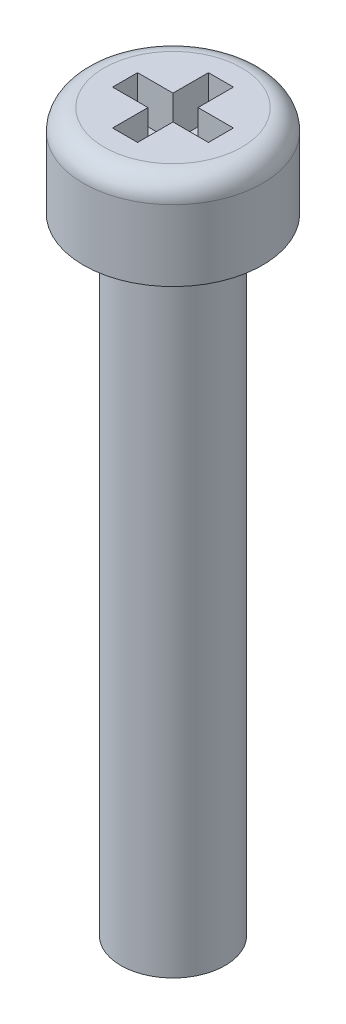
from build123d import *

# Parameters (mm, degrees)
SKETCH2_R     = 1.25
SHAFT_DEPTH   = 15
PHILIPS_DEPTH = 1


with BuildPart() as part:
    # Sketch2 → Shaft (new body)
    with BuildSketch(Plane(origin=(0, 0, 0), x_dir=(1, 0, 0), z_dir=(0, 1, 0))):
        Circle(SKETCH2_R)
    extrude(amount=-SHAFT_DEPTH)

    # Sketch3 → Head (revolve)
    with BuildSketch(Plane.XY):
        with BuildLine():
            Line((0, 0), (0, 2.2))
            Line((0, 2.2), (1.65, 2.2))
            ThreePointArc((1.65, 2.2), (2.003553391, 2.053553391), (2.15, 1.7))
            Line((2.15, 1.7), (2.15, 0))
            Line((2.15, 0), (0, 0))
        make_face()
    revolve(axis=Axis((0, 0, 0), (0, 1, 0)))

    # Sketch5 → Philips (cut)
    with BuildSketch(Plane(origin=(0, 2.2, 0), x_dir=(1, 0, 0), z_dir=(0, 1, 0))):
        Polygon((-0.3, -1.15), (0.3, -1.15), (0.3, -0.3), (1.15, -0.3), (1.15, 0.3), (0.3, 0.3), (0.3, 1.15), (-0.3, 1.15), (-0.3, 0.3), (-1.15, 0.3), (-1.15, -0.3), (-0.3, -0.3), align=None)
    extrude(amount=-PHILIPS_DEPTH, mode=Mode.SUBTRACT)


solid = part.part
